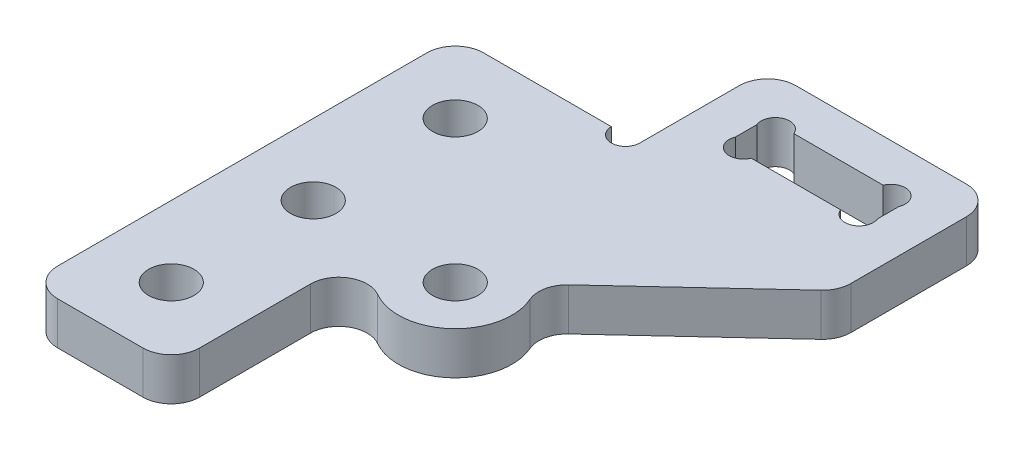
from build123d import *

# Parameters (mm, degrees)
SKETCH_1_W          = 10
SKETCH_1_H          = 30
SKETCH_1_R          = 1.6
EXTRUDE_1_DEPTH     = 3
SKETCH_5_R          = 1.6
SKETCH_5_W          = 10
SKETCH_5_H          = 3
EXTRUDE_4_DEPTH     = 3
SKETCH_6_R          = 1
CUT_EXTRUDE_1_DEPTH = 35.073450075
FILLET_1_R          = 2


with BuildPart() as part:
    # 草图1 → 凸台-拉伸1 (new body)
    with BuildSketch(Plane(origin=(0, 0, 0), x_dir=(1, 0, 0), z_dir=(0, 1, 0))):
        Rectangle(SKETCH_1_W, SKETCH_1_H)
        with Locations(Location((0, 0, 0), (0, 0, 270))):
            Circle(SKETCH_1_R, mode=Mode.SUBTRACT)
        with Locations(Location((0, 10, 0), (0, 0, 270))):
            Circle(SKETCH_1_R, mode=Mode.SUBTRACT)
        with Locations(Location((0, -10, 0), (0, 0, 90))):
            Circle(SKETCH_1_R, mode=Mode.SUBTRACT)
    extrude(amount=EXTRUDE_1_DEPTH)

    # 草图5 → 凸台-拉伸4 (add)
    with BuildSketch(Plane.XZ):
        with BuildLine():
            Line((24, -13), (24, -24))
            Line((24, -24), (8, -24))
            Line((8, -24), (8, -15))
            Line((8, -15), (5, -15))
            Line((5, -15), (5, 5.196152423))
            ThreePointArc((5, 5.196152423), (6, 3.464101615), (8, 3.464101615))
            ThreePointArc((8, 3.464101615), (13.127799472, 2.493365288), (12.931173967, -2.721804397))
            Line((12.931173967, -2.721804397), (24, -13))
        make_face()
        with Locations(Location((10, 0, 0), (0, 0, 270))):
            Circle(SKETCH_5_R, mode=Mode.SUBTRACT)
        with Locations((16, -19.5)):
            Rectangle(SKETCH_5_W, SKETCH_5_H, mode=Mode.SUBTRACT)
    extrude(amount=-EXTRUDE_4_DEPTH)

    # 草图6 → 切除-拉伸1 (cut, through all)
    with BuildSketch(Plane.XZ):
        with Locations((20.072975189, -18.375)):
            Circle(SKETCH_6_R)
        with Locations((11.927024811, -18.375)):
            Circle(SKETCH_6_R)
        with Locations((11.927024811, -20.625)):
            Circle(SKETCH_6_R)
        with Locations((20.072975189, -20.625)):
            Circle(SKETCH_6_R)
        with Locations((7, -15)):
            Circle(SKETCH_6_R)
    extrude(amount=-CUT_EXTRUDE_1_DEPTH, mode=Mode.SUBTRACT)

    # 圆角1
    fillet_1_edges = [part.edges().sort_by_distance(p)[0] for p in [
        (8, 1.5, -24),
        (24, 1.5, -24),
        (24, 1.5, -13),
        (12.931173967, 1.5, -2.721804397),
        (5, 1.5, 15),
        (-5, 1.5, 15),
        (-5, 1.5, -15),
    ]]
    fillet(fillet_1_edges, radius=FILLET_1_R)


solid = part.part
